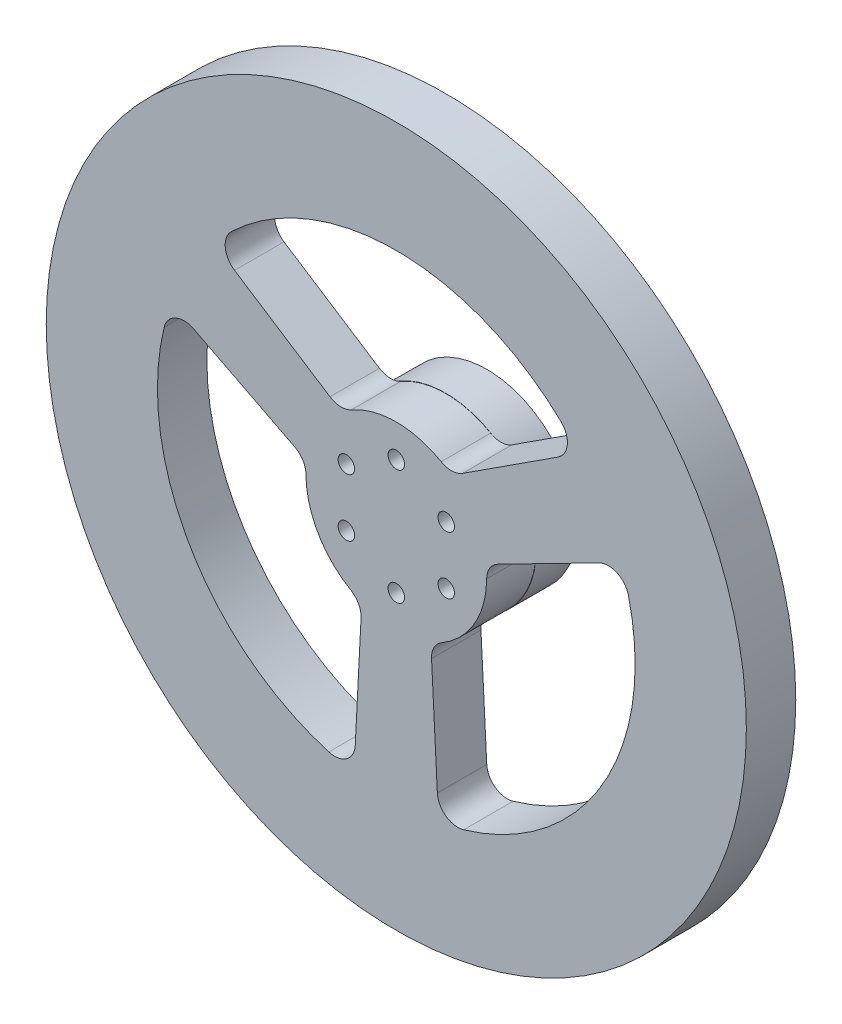
from build123d import *

# Parameters (mm, degrees)
SKETCH1_R               = 85
SKETCH1_R_2             = 2
BOSS_EXTRUDE1_DEPTH     = 12
SKETCH3_R               = 22
BOSS_EXTRUDE2_DEPTH     = 10
CUT_EXTRUDE1_DEPTH      = 123.204746225
CUT_EXTRUDE1_DEPTH_BACK = 123.204746225
SKETCH5_R               = 2


with BuildPart() as part:
    # Sketch1 → Boss-Extrude1 (new body)
    with BuildSketch(Plane.XY):
        Circle(SKETCH1_R)
        with Locations((0, 14)):
            Circle(SKETCH1_R_2, mode=Mode.SUBTRACT)
        with Locations((12.124355653, 7)):
            Circle(SKETCH1_R_2, mode=Mode.SUBTRACT)
        with Locations((12.124355653, -7)):
            Circle(SKETCH1_R_2, mode=Mode.SUBTRACT)
        with Locations((0, -14)):
            Circle(SKETCH1_R_2, mode=Mode.SUBTRACT)
        with Locations((-12.124355653, -7)):
            Circle(SKETCH1_R_2, mode=Mode.SUBTRACT)
        with Locations((-12.124355653, 7)):
            Circle(SKETCH1_R_2, mode=Mode.SUBTRACT)
        with BuildLine():
            Line((-16.104768385, 19.179115852), (-39.269994022, 34.182407181))
            ThreePointArc((-39.269994022, 34.182407181), (-41.530272968, 37.914054118), (-40.000243417, 41.999768173))
            ThreePointArc((-40.000243417, 41.999768173), (0, 58), (40.000243417, 41.999768173))
            ThreePointArc((40.000243417, 41.999768173), (41.530272968, 37.914054118), (39.269994022, 34.182407181))
            Line((39.269994022, 34.182407181), (16.104768385, 19.179115852))
            ThreePointArc((16.104768385, 19.179115852), (13.523321314, 18.377673488), (10.90195317, 19.036921468))
            ThreePointArc((10.90195317, 19.036921468), (0, 21.937569645), (-10.90195317, 19.036921468))
            ThreePointArc((-10.90195317, 19.036921468), (-13.523321314, 18.377673488), (-16.104768385, 19.179115852))
        make_face(mode=Mode.SUBTRACT)
        with BuildLine():
            Line((8.557217358, -23.53669647), (9.96783597, -51.100016021))
            ThreePointArc((9.96783597, -51.100016021), (12.069397543, -54.923298475), (16.372744483, -55.641111043))
            ThreePointArc((16.372744483, -55.641111043), (50.229473419, -29), (56.372987899, 13.64134287))
            ThreePointArc((56.372987899, 13.64134287), (53.59967051, 17.009244357), (49.237829993, 16.917608839))
            Line((49.237829993, 16.917608839), (24.661985743, 4.357580618))
            ThreePointArc((24.661985743, 4.357580618), (22.67719276, 2.522703057), (21.937434187, -0.077092338))
            ThreePointArc((21.937434187, -0.077092338), (18.99849261, -10.968784822), (11.035481016, -18.95982913))
            ThreePointArc((11.035481016, -18.95982913), (9.153871447, -20.900376546), (8.557217358, -23.53669647))
        make_face(mode=Mode.SUBTRACT)
        with BuildLine():
            Line((-24.661985743, 4.357580618), (-49.237829993, 16.917608839))
            ThreePointArc((-49.237829993, 16.917608839), (-53.59967051, 17.009244357), (-56.372987899, 13.64134287))
            ThreePointArc((-56.372987899, 13.64134287), (-50.229473419, -29), (-16.372744483, -55.641111043))
            ThreePointArc((-16.372744483, -55.641111043), (-12.069397543, -54.923298475), (-9.96783597, -51.100016021))
            Line((-9.96783597, -51.100016021), (-8.557217358, -23.53669647))
            ThreePointArc((-8.557217358, -23.53669647), (-9.153871447, -20.900376546), (-11.035481016, -18.95982913))
            ThreePointArc((-11.035481016, -18.95982913), (-18.99849261, -10.968784822), (-21.937434187, -0.077092338))
            ThreePointArc((-21.937434187, -0.077092338), (-22.67719276, 2.522703057), (-24.661985743, 4.357580618))
        make_face(mode=Mode.SUBTRACT)
    extrude(amount=BOSS_EXTRUDE1_DEPTH)

    # Sketch3 → Boss-Extrude2 (add)
    with BuildSketch(Plane(origin=(0, 0, 0), x_dir=(-1, 0, 0), z_dir=(0, 0, -1))):
        with Locations(Location((0, 0, 0), (0, 0, 178.347435868))):
            Circle(SKETCH3_R)
    extrude(amount=BOSS_EXTRUDE2_DEPTH)

    # Sketch5 → Cut-Extrude1 (cut, two sides: drawn at the far end of the back side and taken through both)
    with BuildSketch(Plane.XY.offset(12).offset(-CUT_EXTRUDE1_DEPTH_BACK)):
        with Locations((0, 14)):
            Circle(SKETCH5_R)
        with Locations((12.124355653, 7)):
            Circle(SKETCH5_R)
        with Locations((12.124355653, -7)):
            Circle(SKETCH5_R)
        with Locations((0, -14)):
            Circle(SKETCH5_R)
        with Locations((-12.124355653, -7)):
            Circle(SKETCH5_R)
        with Locations((-12.124355653, 7)):
            Circle(SKETCH5_R)
    extrude(amount=CUT_EXTRUDE1_DEPTH + CUT_EXTRUDE1_DEPTH_BACK, mode=Mode.SUBTRACT)


solid = part.part
